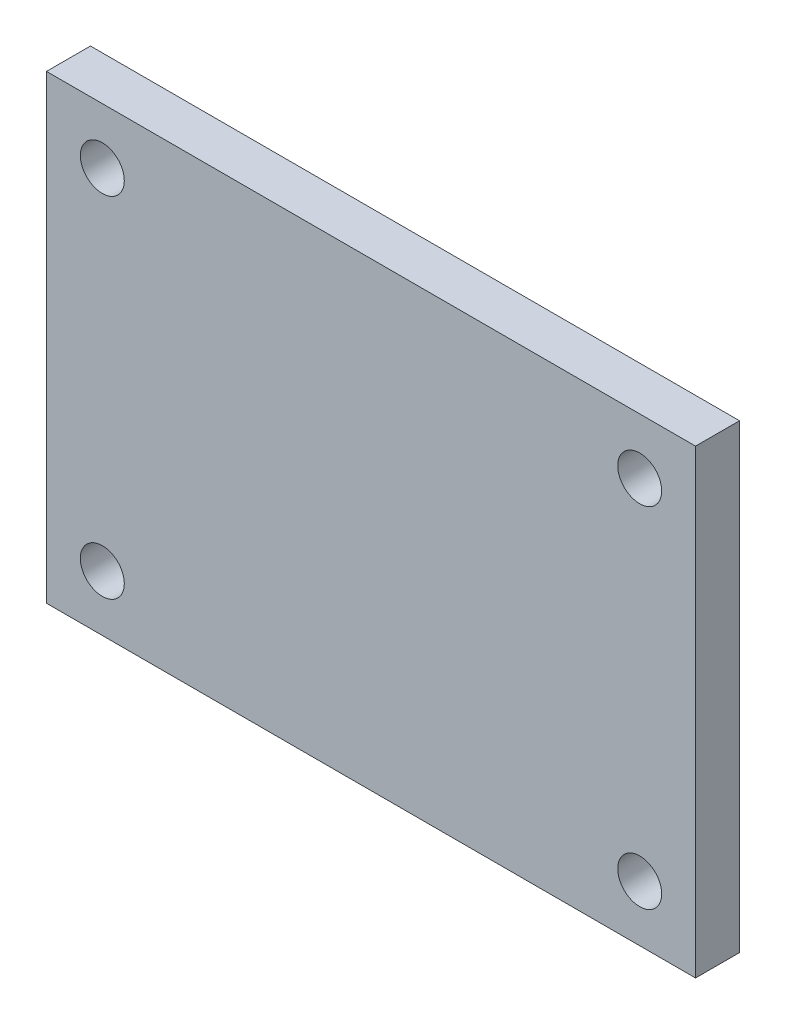
from build123d import *

# Parameters (mm, degrees)
ESQUISSE1_W             = 47.244
ESQUISSE1_H             = 33.528
BOSS_EXTRU_1_DEPTH      = 3.2
ESQUISSE2_R             = 1.6
ENL_V_MAT_EXTRU_1_DEPTH = 3.2


with BuildPart() as part:
    # Esquisse1 → Boss.-Extru.1 (new body)
    with BuildSketch(Plane.XY):
        with Locations((23.622, 16.764)):
            Rectangle(ESQUISSE1_W, ESQUISSE1_H)
    extrude(amount=BOSS_EXTRU_1_DEPTH)

    # Esquisse2 → Enlèv. mat.-Extru.1 (cut)
    with BuildSketch(Plane.XY.offset(3.2)):
        with Locations((4.064, 29.464)):
            Circle(ESQUISSE2_R)
        with Locations((43.18, 29.464)):
            Circle(ESQUISSE2_R)
        with Locations((43.18, 4.064)):
            Circle(ESQUISSE2_R)
        with Locations((4.064, 4.064)):
            Circle(ESQUISSE2_R)
    extrude(amount=-ENL_V_MAT_EXTRU_1_DEPTH, mode=Mode.SUBTRACT)


solid = part.part
